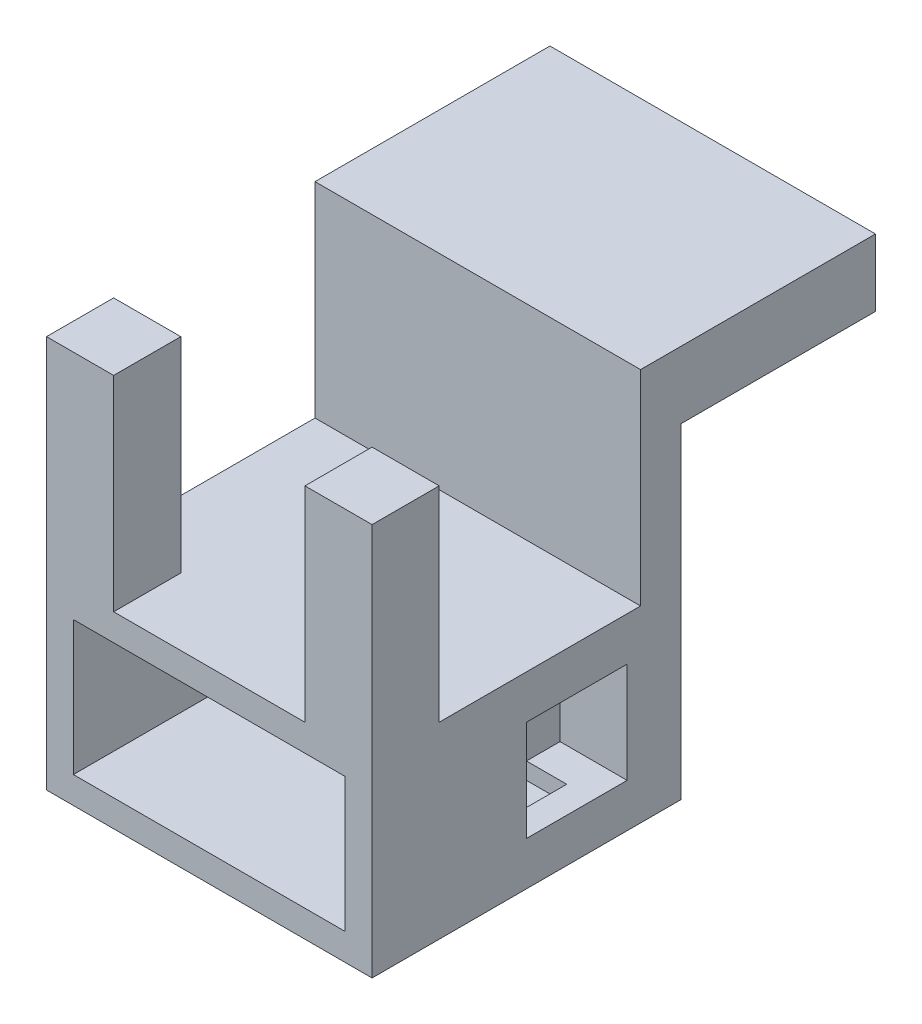
from build123d import *

# Parameters (mm, degrees)
SKETCH1_W           = 48.5
SKETCH1_H           = 28
SKETCH1_W_2         = 40.5
SKETCH1_H_2         = 20
BOSS_EXTRUDE1_DEPTH = 40
SKETCH2_W           = 48.5
SKETCH2_H           = 28
BOSS_EXTRUDE2_DEPTH = 7
SKETCH3_W           = 15
SKETCH3_H           = 15
CUT_EXTRUDE1_DEPTH  = 10
SKETCH4_W           = 48.5
SKETCH4_H           = 58.5
BOSS_EXTRUDE3_DEPTH = 6
SKETCH4_3_W         = 48.5
SKETCH4_3_H         = 10
BOSS_EXTRUDE4_DEPTH = 35
SKETCH5_W           = 10
SKETCH5_H           = 10
BOSS_EXTRUDE5_DEPTH = 30.5


with BuildPart() as part:
    # Sketch1 → Boss-Extrude1 (new body)
    with BuildSketch(Plane(origin=(0, 0, -17.55), x_dir=(-1, 0, 0), z_dir=(0, 0, -1))):
        with Locations((-10.25, 0)):
            Rectangle(SKETCH1_W, SKETCH1_H)
        with Locations((-10.25, 0)):
            Rectangle(SKETCH1_W_2, SKETCH1_H_2, mode=Mode.SUBTRACT)
    extrude(amount=BOSS_EXTRUDE1_DEPTH)

    # Sketch2 → Boss-Extrude2 (add)
    with BuildSketch(Plane(origin=(0, 0, -57.55), x_dir=(-1, 0, 0), z_dir=(0, 0, -1))):
        with Locations((-10.25, 0)):
            Rectangle(SKETCH2_W, SKETCH2_H)
    extrude(amount=-BOSS_EXTRUDE2_DEPTH)

    # Sketch3 → Cut-Extrude1 (cut)
    with BuildSketch(Plane(origin=(34.5, 0, 0), x_dir=(0, 0, -1), z_dir=(1, 0, 0))):
        with Locations((48.05, 0)):
            Rectangle(SKETCH3_W, SKETCH3_H)
    extrude(amount=-CUT_EXTRUDE1_DEPTH, mode=Mode.SUBTRACT)

    # Sketch4 → Boss-Extrude3 (add)
    with BuildSketch(Plane(origin=(0, 0, -57.55), x_dir=(-1, 0, 0), z_dir=(0, 0, -1))):
        with Locations((-10.25, 15.25)):
            Rectangle(SKETCH4_W, SKETCH4_H)
    extrude(amount=BOSS_EXTRUDE3_DEPTH)

    # Sketch4<3> → Boss-Extrude4 (add)
    with BuildSketch(Plane(origin=(0, 0, -57.55), x_dir=(-1, 0, 0), z_dir=(0, 0, -1))):
        with Locations((-10.25, 39.5)):
            Rectangle(SKETCH4_3_W, SKETCH4_3_H)
    extrude(amount=BOSS_EXTRUDE4_DEPTH)

    # Sketch5 → Boss-Extrude5 (add)
    with BuildSketch(Plane.XZ.offset(-14)):
        with Locations((-9, -22.55)):
            Rectangle(SKETCH5_W, SKETCH5_H)
        with Locations((29.5, -22.55)):
            Rectangle(SKETCH5_W, SKETCH5_H)
    extrude(amount=-BOSS_EXTRUDE5_DEPTH)


solid = part.part
